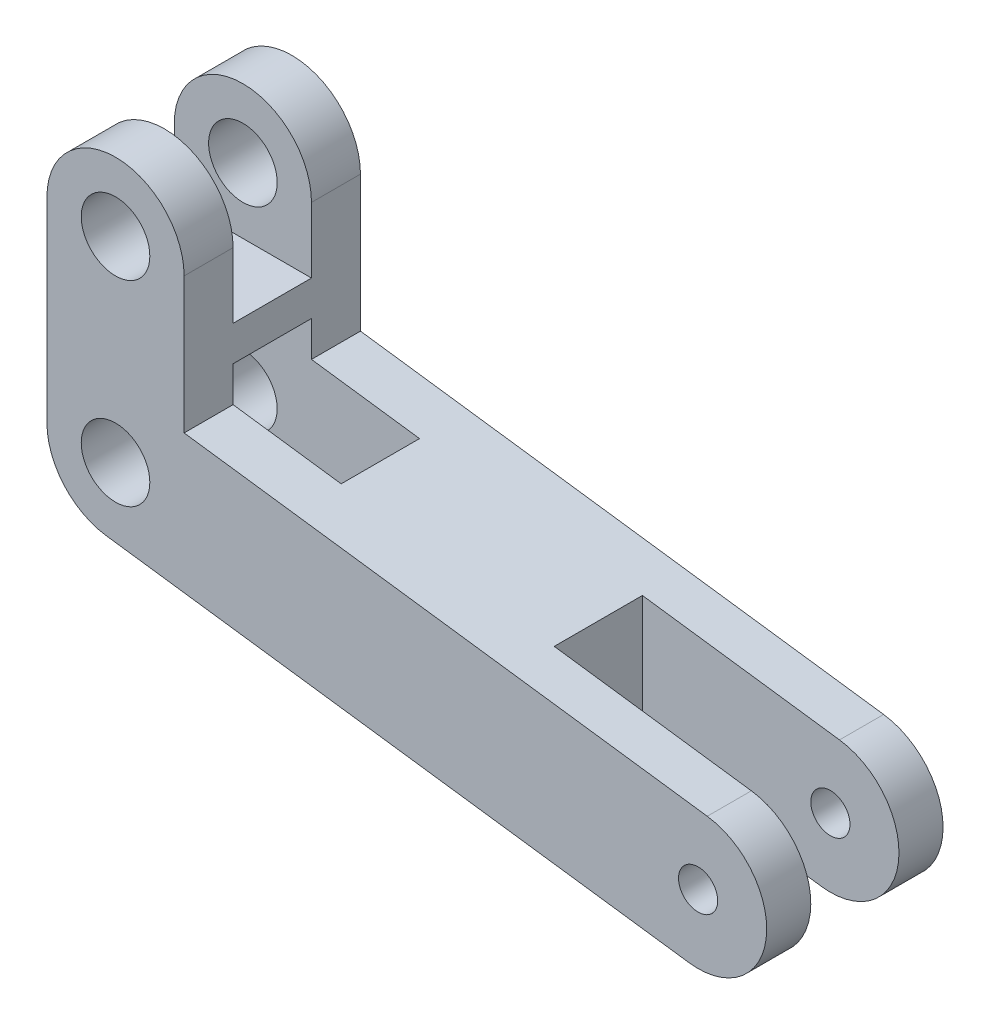
from build123d import *

# Parameters (mm, degrees)
SKETCH_1_R          = 1.75
SKETCH_1_R_2        = 1
EXTRUDE_1_DEPTH     = 4.5
SKETCH_5_W          = 9.199682462
SKETCH_5_H          = 9.813167506
SKETCH_5_W_2        = 14.660354758
SKETCH_5_H_2        = 10.525453646
CUT_EXTRUDE_3_DEPTH = 2
SKETCH_6_W          = 19.186818514
SKETCH_6_H          = 12
CUT_EXTRUDE_4_DEPTH = 2.25


with BuildPart() as part:
    # 草图1 → 凸台-拉伸1 (new, symmetric)
    with BuildSketch(Plane.XY):
        with BuildLine():
            Line((29.265470828, -7.468749374), (-0.466666667, -3.468749374))
            ThreePointArc((-0.466666667, -3.468749374), (-2.634704284, -2.30398206), (-3.5, 0))
            Line((-3.5, 0), (-3.5, 10))
            ThreePointArc((-3.5, 10), (0, 13.5), (3.5, 10))
            Line((3.5, 10), (3.5, 3.060661213))
            Line((3.5, 3.060661213), (30.198804161, -0.531250626))
            ThreePointArc((30.198804161, -0.531250626), (33.200886869, -4.466666667), (29.265470828, -7.468749374))
        make_face()
        Circle(SKETCH_1_R, mode=Mode.SUBTRACT)
        with Locations((0, 10)):
            Circle(SKETCH_1_R, mode=Mode.SUBTRACT)
        with Locations((29.732137495, -4)):
            Circle(SKETCH_1_R_2, mode=Mode.SUBTRACT)
    extrude(amount=EXTRUDE_1_DEPTH, both=True)

    # 草图5 → 切除-拉伸3 (cut, symmetric)
    with BuildSketch(Plane.XY):
        with Locations((-1.099841231, 11.563279791)):
            Rectangle(SKETCH_5_W, SKETCH_5_H)
        with Locations((1.684655549, -0.393377614)):
            Rectangle(SKETCH_5_W_2, SKETCH_5_H_2)
    extrude(amount=CUT_EXTRUDE_3_DEPTH, both=True, mode=Mode.SUBTRACT)

    # 草图6 → 切除-拉伸4 (cut, symmetric)
    with BuildSketch(Plane.XY):
        with Locations((29.732137495, -4)):
            Rectangle(SKETCH_6_W, SKETCH_6_H)
    extrude(amount=CUT_EXTRUDE_4_DEPTH, both=True, mode=Mode.SUBTRACT)


solid = part.part
